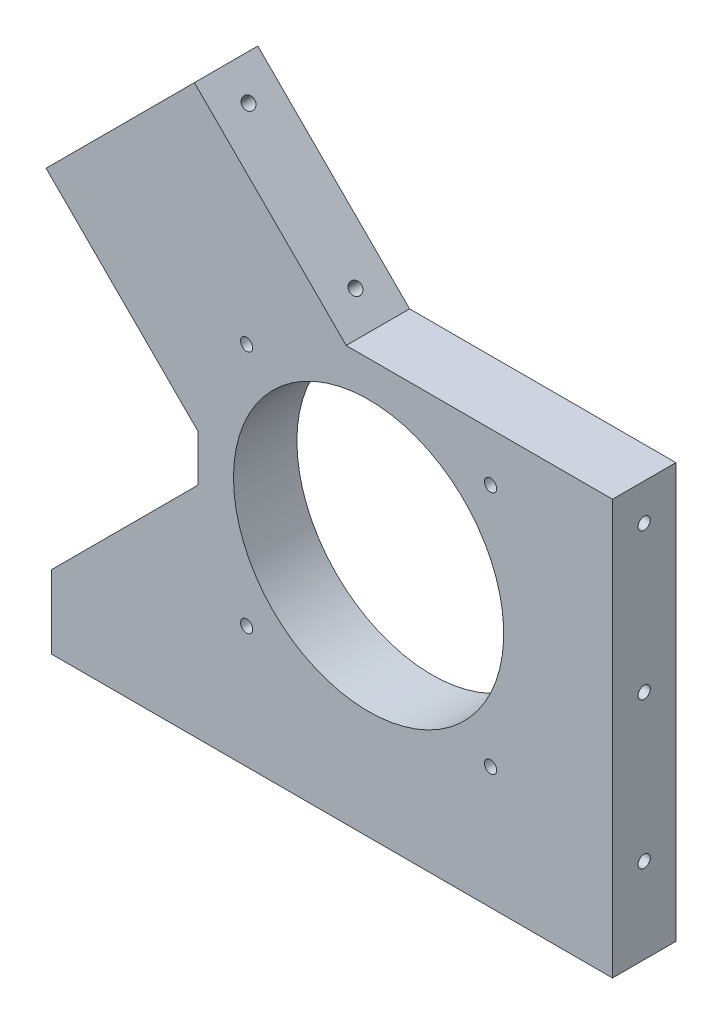
from build123d import *

# Parameters (mm, degrees)
SKETCH1_R           = 27.7
SKETCH1_R_2         = 1.25
BOSS_EXTRUDE1_DEPTH = 13
CUT_EXTRUDE1_REACH  = 107.038
SKETCH2_R           = 1.25
SKETCH3_R           = 1.25
CUT_EXTRUDE2_DEPTH  = 15
SKETCH4_R           = 1.25
CUT_EXTRUDE3_DEPTH  = 15


with BuildPart() as part:
    # Sketch1 → Boss-Extrude1 (new body)
    with BuildSketch(Plane.XY):
        Polygon((50, 35), (50, -50), (-65, -50), (-65, -35), (-35, -5), (-35, 4.594408409), (-66.114484041, 35.70889245), (-50.911688245, 50.911688245), (-35.70889245, 66.114484041), (-4.594408409, 35), align=None)
        with Locations(Location((0, 0, 0), (0, 0, 180))):
            Circle(SKETCH1_R, mode=Mode.SUBTRACT)
        with Locations(Location((-25, 25, 0), (0, 0, 180))):
            Circle(SKETCH1_R_2, mode=Mode.SUBTRACT)
        with Locations(Location((25, 25, 0), (0, 0, 180))):
            Circle(SKETCH1_R_2, mode=Mode.SUBTRACT)
        with Locations(Location((25, -25, 0), (0, 0, 180))):
            Circle(SKETCH1_R_2, mode=Mode.SUBTRACT)
        with Locations(Location((-25, -25, 0), (0, 0, 180))):
            Circle(SKETCH1_R_2, mode=Mode.SUBTRACT)
    extrude(amount=BOSS_EXTRUDE1_DEPTH)

    # Sketch2 → Cut-Extrude1 (cut, up to next)
    with BuildSketch(Plane(origin=(-15.202795796, -15.202795796, 0), x_dir=(0, 0, 1), z_dir=(-0.7071067811865472, -0.7071067811865478, 0)), mode=Mode.PRIVATE) as cut_extrude1_sk1:
        with Locations(Location((6.5, 65.5, 0), (0, 0, 270))):
            Circle(SKETCH2_R)
    cut_extrude1_tool1 = extrude(cut_extrude1_sk1.sketch, amount=-CUT_EXTRUDE1_REACH, mode=Mode.PRIVATE) & part.part
    # Sketch2 → Cut-Extrude1 (cut, up to next)
    with BuildSketch(Plane(origin=(-15.202795796, -15.202795796, 0), x_dir=(0, 0, 1), z_dir=(-0.7071067811865472, -0.7071067811865478, 0)), mode=Mode.PRIVATE) as cut_extrude1_sk2:
        with Locations(Location((6.5, 34.5, 0), (0, 0, 270))):
            Circle(SKETCH2_R)
    cut_extrude1_tool2 = extrude(cut_extrude1_sk2.sketch, amount=-CUT_EXTRUDE1_REACH, mode=Mode.PRIVATE) & part.part
    add(cut_extrude1_tool1.solids().sort_by_distance((-61.51829, 31.112698, 6.5))[0], mode=Mode.SUBTRACT)
    add(cut_extrude1_tool2.solids().sort_by_distance((-39.59798, 9.192388, 6.5))[0], mode=Mode.SUBTRACT)

    # Sketch3 → Cut-Extrude2 (cut)
    with BuildSketch(Plane.XZ.offset(50)):
        with Locations((-57.5, 6.5)):
            Circle(SKETCH3_R)
        with Locations((32.5, 6.5)):
            Circle(SKETCH3_R)
        with Locations((-12.5, 6.5)):
            Circle(SKETCH3_R)
    extrude(amount=-CUT_EXTRUDE2_DEPTH, mode=Mode.SUBTRACT)

    # Sketch4 → Cut-Extrude3 (cut)
    with BuildSketch(Plane(origin=(50, 0, 0), x_dir=(0, 0, -1), z_dir=(1, 0, 0))):
        with Locations(Location((-6.5, -32.5, 0), (0, 0, 90))):
            Circle(SKETCH4_R)
        with Locations(Location((-6.5, 27.5, 0), (0, 0, 90))):
            Circle(SKETCH4_R)
        with Locations(Location((-6.5, -2.5, 0), (0, 0, 90))):
            Circle(SKETCH4_R)
    extrude(amount=-CUT_EXTRUDE3_DEPTH, mode=Mode.SUBTRACT)


solid = part.part
